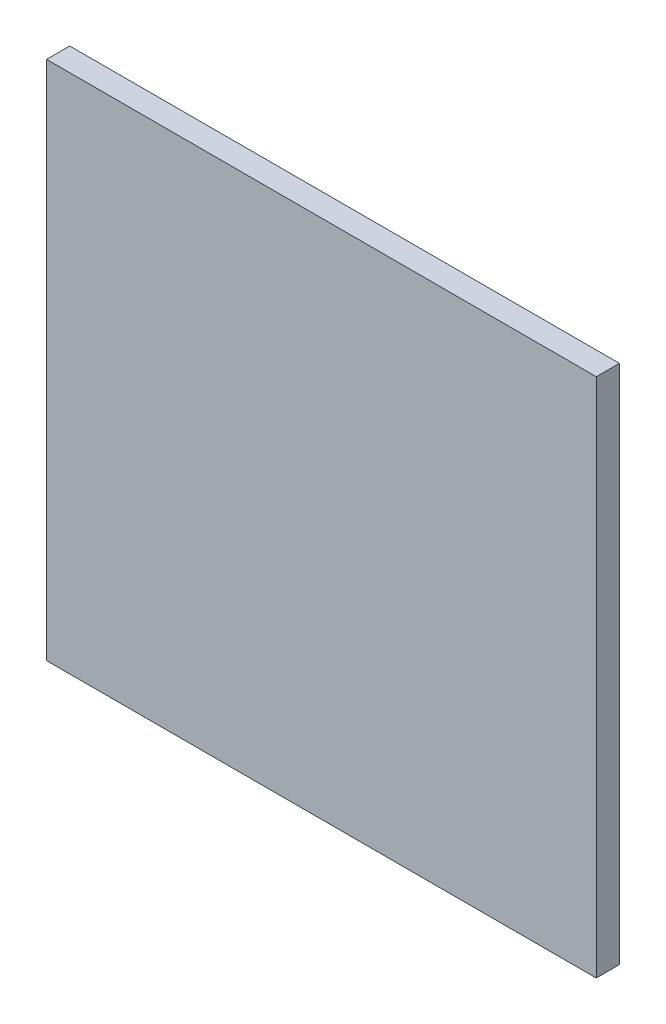
from build123d import *

# Parameters (mm, degrees)
SKETCH1_W           = 38
SKETCH1_H           = 36
BOSS_EXTRUDE1_DEPTH = 1.6


with BuildPart() as part:
    # Sketch1 → Boss-Extrude1 (new body)
    with BuildSketch(Plane.XY):
        with Locations((19, -18)):
            Rectangle(SKETCH1_W, SKETCH1_H)
    extrude(amount=BOSS_EXTRUDE1_DEPTH)


solid = part.part
